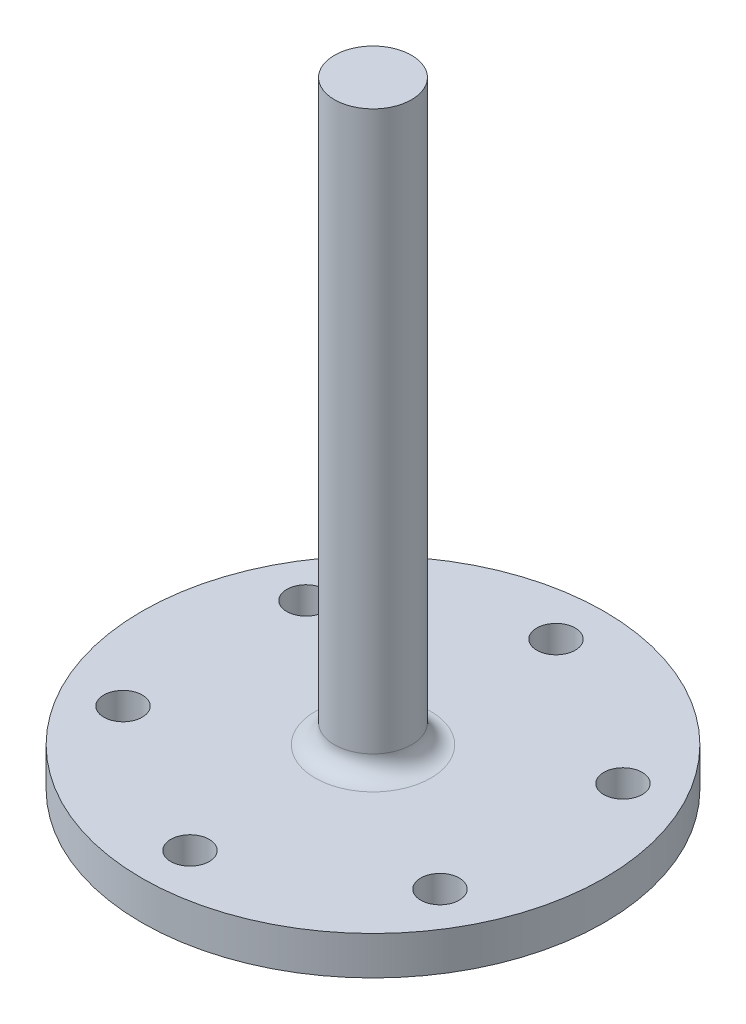
from build123d import *

# Parameters (mm, degrees)
SKETCH1_R           = 30
SKETCH1_R_2         = 2.5
BOSS_EXTRUDE1_DEPTH = 5
SKETCH2_R           = 5
BOSS_EXTRUDE2_DEPTH = 75
FILLET1_R           = 2.5


with BuildPart() as part:
    # Sketch1 → Boss-Extrude1 (new body)
    with BuildSketch(Plane(origin=(0, 0, 0), x_dir=(1, 0, 0), z_dir=(0, 1, 0))):
        with Locations(Location((0, 0, 0), (0, 0, 270))):
            Circle(SKETCH1_R)
        with Locations(Location((-20.56810334, 11.875, 0), (0, 0, 270))):
            Circle(SKETCH1_R_2, mode=Mode.SUBTRACT)
        with Locations(Location((0, 23.75, 0), (0, 0, 270))):
            Circle(SKETCH1_R_2, mode=Mode.SUBTRACT)
        with Locations(Location((20.56810334, 11.875, 0), (0, 0, 270))):
            Circle(SKETCH1_R_2, mode=Mode.SUBTRACT)
        with Locations(Location((20.56810334, -11.875, 0), (0, 0, 270))):
            Circle(SKETCH1_R_2, mode=Mode.SUBTRACT)
        with Locations(Location((0, -23.75, 0), (0, 0, 270))):
            Circle(SKETCH1_R_2, mode=Mode.SUBTRACT)
        with Locations(Location((-20.56810334, -11.875, 0), (0, 0, 270))):
            Circle(SKETCH1_R_2, mode=Mode.SUBTRACT)
    extrude(amount=BOSS_EXTRUDE1_DEPTH)

    # Sketch2 → Boss-Extrude2 (add)
    with BuildSketch(Plane(origin=(0, 5, 0), x_dir=(1, 0, 0), z_dir=(0, 1, 0))):
        with Locations(Location((0, 0, 0), (0, 0, 270))):
            Circle(SKETCH2_R)
    extrude(amount=BOSS_EXTRUDE2_DEPTH)

    # Fillet1
    fillet1_edges = [part.edges().sort_by_distance(p)[0] for p in [
        (0, 5, -5),
    ]]
    fillet(fillet1_edges, radius=FILLET1_R)


solid = part.part
